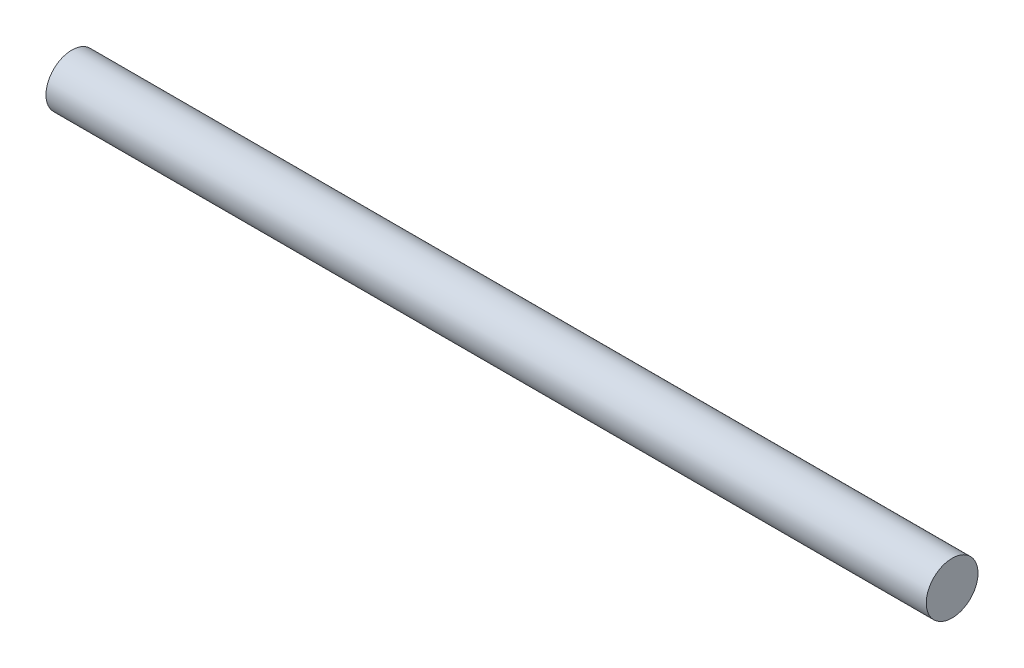
from build123d import *

# Parameters (mm, degrees)
SKETCH1_R           = 2.54
BOSS_EXTRUDE1_DEPTH = 86.36


with BuildPart() as part:
    # Sketch1 → Boss-Extrude1 (new body)
    with BuildSketch(Plane(origin=(0, 0, 0), x_dir=(0, 0, -1), z_dir=(1, 0, 0))):
        Circle(SKETCH1_R)
    extrude(amount=BOSS_EXTRUDE1_DEPTH)


solid = part.part
